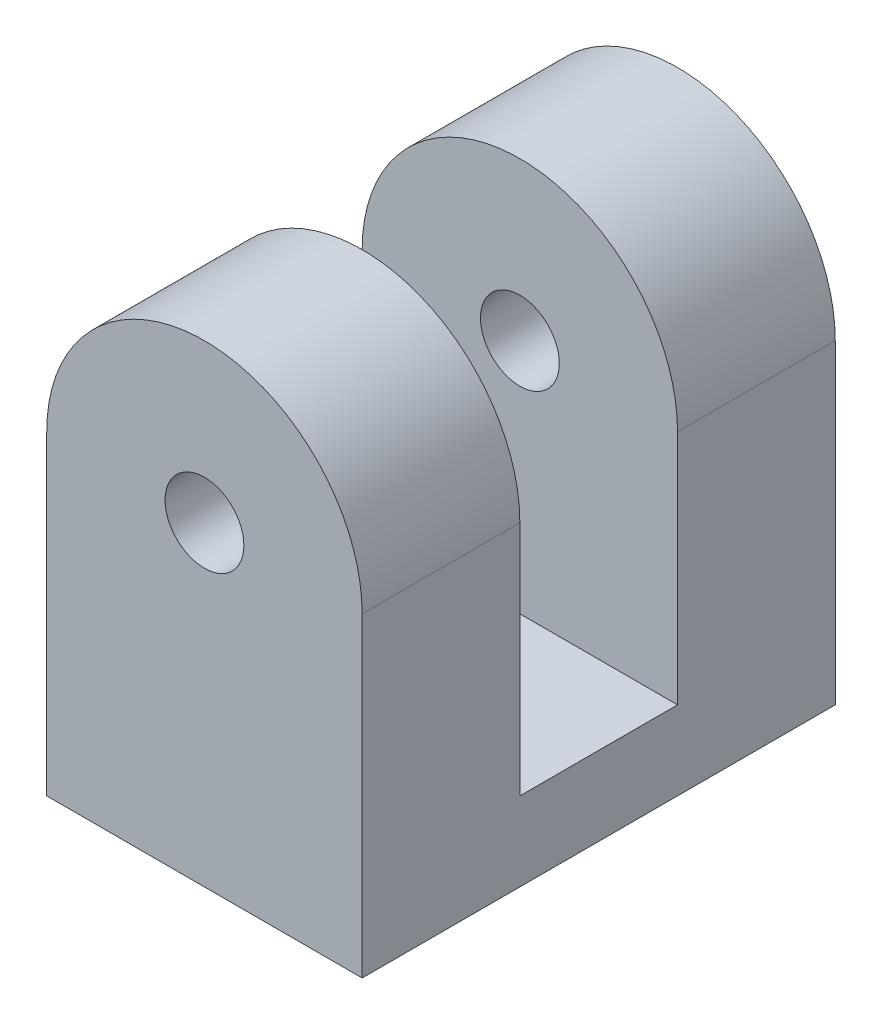
from build123d import *

# Parameters (mm, degrees)
BOSS_EXTRUDE1_START = 5
SKETCH1_R           = 2.5
BOSS_EXTRUDE1_DEPTH = 10
BOSS_EXTRUDE2_START = -5
SKETCH1_2_R         = 2.5
BOSS_EXTRUDE2_DEPTH = 10
SKETCH2_W           = 20
SKETCH2_H           = 30
BOSS_EXTRUDE3_DEPTH = 5


with BuildPart() as part:
    # Sketch1 → Boss-Extrude1 (new body)
    with BuildSketch(Plane.XY.offset(BOSS_EXTRUDE1_START)):
        with BuildLine():
            Line((-10, 15), (-10, 0))
            Line((-10, 0), (10, 0))
            Line((10, 0), (10, 15))
            ThreePointArc((10, 15), (0, 25), (-10, 15))
        make_face()
        with Locations((0, 15)):
            Circle(SKETCH1_R, mode=Mode.SUBTRACT)
    extrude(amount=BOSS_EXTRUDE1_DEPTH)



with BuildPart() as body_2:
    # Sketch1<2> → Boss-Extrude2 (new body)
    with BuildSketch(Plane.XY.offset(BOSS_EXTRUDE2_START)):
        with BuildLine():
            Line((-10, 15), (-10, 0))
            Line((-10, 0), (10, 0))
            Line((10, 0), (10, 15))
            ThreePointArc((10, 15), (0, 25), (-10, 15))
        make_face()
        with Locations((0, 15)):
            Circle(SKETCH1_2_R, mode=Mode.SUBTRACT)
    extrude(amount=-BOSS_EXTRUDE2_DEPTH)


with BuildPart() as part_1:
    add(part.part)

    add(body_2.part)  # Boss-Extrude3 merges body 2
    # Sketch2 → Boss-Extrude3 (add)
    with BuildSketch(Plane.XZ):
        Rectangle(SKETCH2_W, SKETCH2_H)
    extrude(amount=BOSS_EXTRUDE3_DEPTH)


solid = part_1.part
